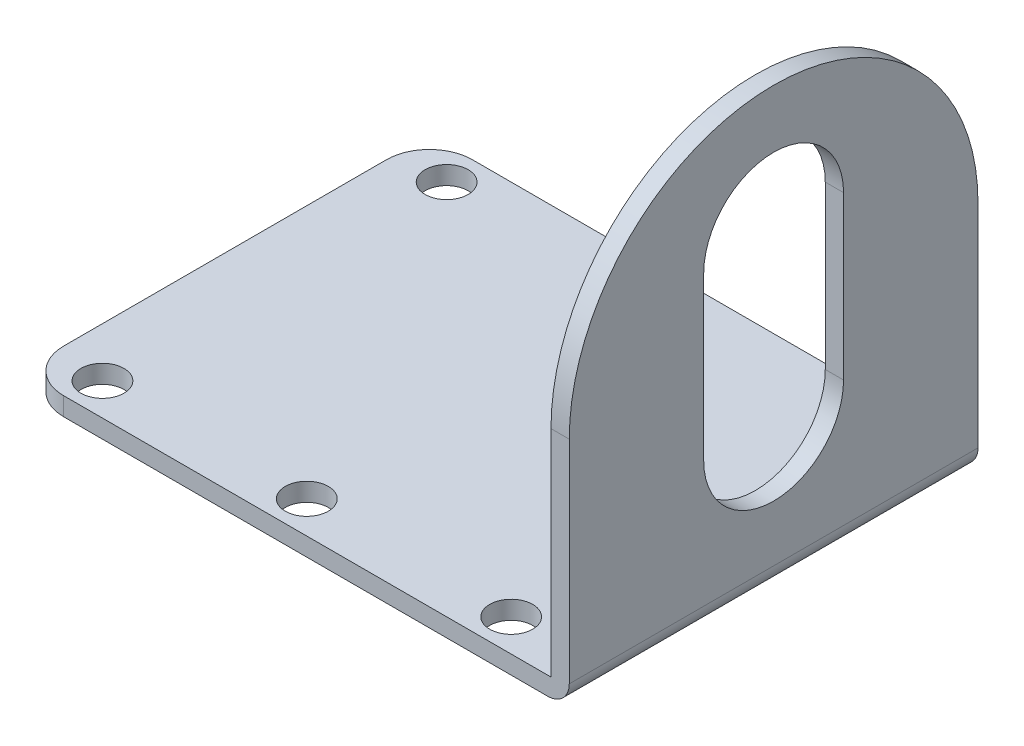
from build123d import *

# Parameters (mm, degrees)
BOSS_EXTRUDE1_DEPTH = 38
FILLET1_R           = 4
FILLET2_R           = 4
FILLET3_RADIUS      = 19
FILLET3_LENGTH      = 1.7
CUT_EXTRUDE1_DEPTH  = 38
SKETCH3_R           = 2
CUT_EXTRUDE2_DEPTH  = 38
FILLET4_R           = 2


with BuildPart() as part:
    # Sketch1 → Boss-Extrude1 (new body)
    with BuildSketch(Plane.XY):
        Polygon((0, 0), (0, 39), (1.7, 39), (1.7, -1.7), (-49.3, -1.7), (-49.3, 0), align=None)
    extrude(amount=BOSS_EXTRUDE1_DEPTH)

    # Fillet1
    fillet1_edges = [part.edges().sort_by_distance(p)[0] for p in [
        (-49.3, -0.85, 0),
    ]]
    fillet(fillet1_edges, radius=FILLET1_R)

    # Fillet2
    fillet2_edges = [part.edges().sort_by_distance(p)[0] for p in [
        (-49.3, -0.85, 38),
    ]]
    fillet(fillet2_edges, radius=FILLET2_R)

    # Fillet3: full round fillet: the end face becomes a half cylinder, R = half its width
    fillet3_face = Plane((0.85, 39, 19), x_dir=(1, 0, 0), z_dir=(0, 1, 0))  # on the end face: x along it, z out of the body
    fillet3_slab = fillet3_face.offset(-FILLET3_RADIUS / 2) * Box(FILLET3_LENGTH, 2 * FILLET3_RADIUS, FILLET3_RADIUS, mode=Mode.PRIVATE)  # the body's end, R deep
    fillet3_round = Plane((0.85, 20, 19), x_dir=(0, 1, 0), z_dir=(1, 0, 0)) * Cylinder(FILLET3_RADIUS, FILLET3_LENGTH, mode=Mode.PRIVATE)  # its axis R under the face
    add(fillet3_slab - fillet3_round, mode=Mode.SUBTRACT)

    # Sketch2 → Cut-Extrude1 (cut)
    with BuildSketch(Plane(origin=(1.7, 0, 0), x_dir=(0, 0, -1), z_dir=(1, 0, 0))):
        with BuildLine():
            Line((-25.5, 12.013917936), (-25.5, 27.1))
            ThreePointArc((-25.5, 27.1), (-19, 33.6), (-12.5, 27.1))
            Line((-12.5, 27.1), (-12.5, 12.013917936))
            ThreePointArc((-12.5, 12.013917936), (-19, 5.513917936), (-25.5, 12.013917936))
        make_face()
    extrude(amount=-CUT_EXTRUDE1_DEPTH, mode=Mode.SUBTRACT)

    # Sketch3 → Cut-Extrude2 (cut)
    with BuildSketch(Plane(origin=(0, -1.7, 0), x_dir=(-1, 0, 0), z_dir=(0, -1, 0))):
        with Locations(Location((44.7, -3, 0), (0, 0, 180))):
            Circle(SKETCH3_R)
        with Locations(Location((25.7, -3, 0), (0, 0, 180))):
            Circle(SKETCH3_R)
        with Locations(Location((6.7, -3, 0), (0, 0, 180))):
            Circle(SKETCH3_R)
        with Locations(Location((6.7, -35, 0), (0, 0, 90))):
            Circle(SKETCH3_R)
        with Locations(Location((25.7, -35, 0), (0, 0, 90))):
            Circle(SKETCH3_R)
        with Locations(Location((44.7, -35, 0), (0, 0, 90))):
            Circle(SKETCH3_R)
    extrude(amount=-CUT_EXTRUDE2_DEPTH, mode=Mode.SUBTRACT)

    # Fillet4
    fillet4_edges = [part.edges().sort_by_distance(p)[0] for p in [
        (1.7, -1.7, 19),
    ]]
    fillet(fillet4_edges, radius=FILLET4_R)


solid = part.part
